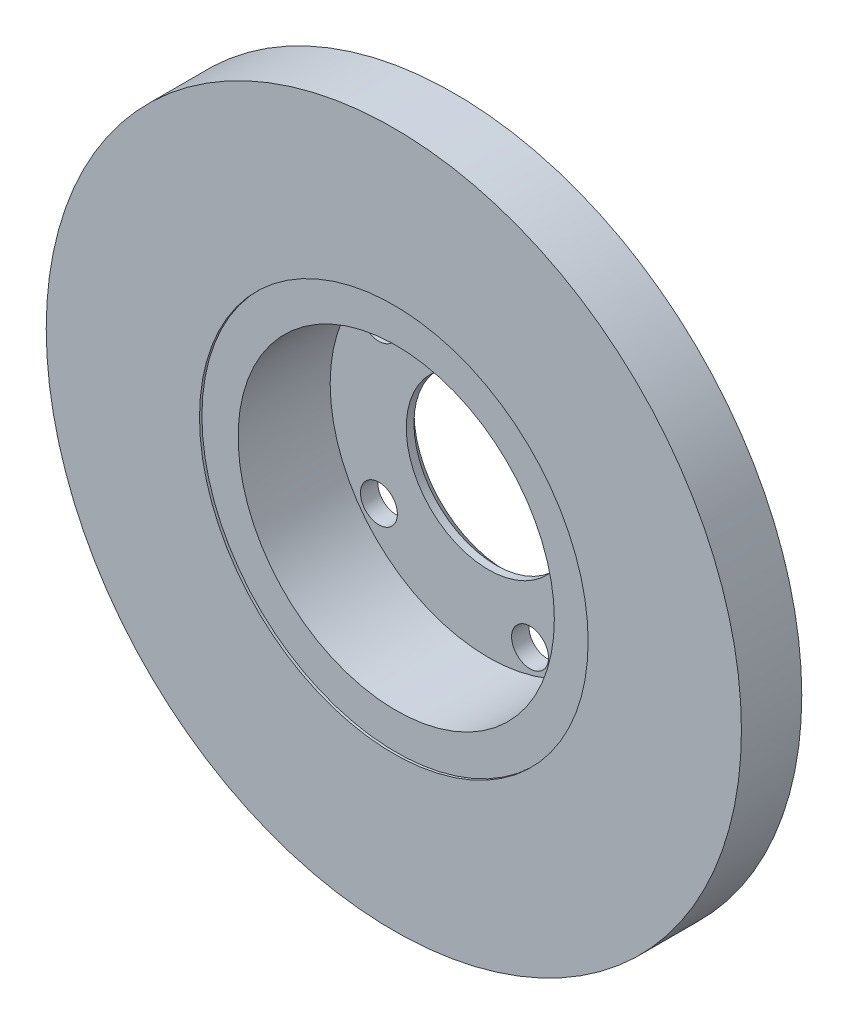
from build123d import *

# Parameters (mm, degrees)
BOSS_EXTRUDE1_START = 2.5
SKETCH1_R           = 144
BOSS_EXTRUDE1_DEPTH = 10
SKETCH2_R           = 80.5
CUT_EXTRUDE1_DEPTH  = 1
SKETCH3_R           = 65.5
CUT_EXTRUDE2_DEPTH  = 204.845529752
SKETCH4_R           = 74.125
SKETCH4_R_2         = 65.5
BOSS_EXTRUDE3_DEPTH = 36.33
BOSS_EXTRUDE4_START = -7.2
SKETCH5_R           = 74.125
BOSS_EXTRUDE4_DEPTH = 7.2
SKETCH6_R           = 34
CUT_EXTRUDE3_DEPTH  = 17.2
SKETCH7_R           = 144
SKETCH7_R_2         = 80.5
BOSS_EXTRUDE5_DEPTH = 15
CHAMFER2_SIZE       = 4
SKETCH10_R          = 7.65
CUT_EXTRUDE4_DEPTH  = 207.437566591
CIRPATTERN2_COUNT   = 5
CHAMFER3_SIZE       = 2
CUT_EXTRUDE6_DEPTH  = 2


with BuildPart() as part:
    # Sketch1 → Boss-Extrude1 (new body)
    with BuildSketch(Plane.XY.offset(BOSS_EXTRUDE1_START)):
        Circle(SKETCH1_R)
    extrude(amount=BOSS_EXTRUDE1_DEPTH)

    # Sketch2 → Cut-Extrude1 (cut)
    with BuildSketch(Plane.XY.offset(12.5)):
        Circle(SKETCH2_R)
    extrude(amount=-CUT_EXTRUDE1_DEPTH, mode=Mode.SUBTRACT)

    # Sketch3 → Cut-Extrude2 (cut, through all)
    with BuildSketch(Plane.XY.offset(11.5)):
        Circle(SKETCH3_R)
    extrude(amount=-CUT_EXTRUDE2_DEPTH, mode=Mode.SUBTRACT)

    # Sketch4 → Boss-Extrude3 (add)
    with BuildSketch(Plane(origin=(0, 0, 2.5), x_dir=(-1, 0, 0), z_dir=(0, 0, -1))):
        with Locations(Location((0, 0, 0), (0, 0, 180))):
            Circle(SKETCH4_R)
        with Locations(Location((0, 0, 0), (0, 0, 180))):
            Circle(SKETCH4_R_2, mode=Mode.SUBTRACT)
    extrude(amount=BOSS_EXTRUDE3_DEPTH)

    # Sketch5 → Boss-Extrude4 (add)
    with BuildSketch(Plane(origin=(0, 0, -33.83), x_dir=(-1, 0, 0), z_dir=(0, 0, -1)).offset(BOSS_EXTRUDE4_START)):
        with Locations(Location((0, 0, 0), (0, 0, 180))):
            Circle(SKETCH5_R)
    extrude(amount=BOSS_EXTRUDE4_DEPTH)

    # Sketch6 → Cut-Extrude3 (cut)
    with BuildSketch(Plane.XY.offset(-26.63)):
        Circle(SKETCH6_R)
    extrude(amount=-CUT_EXTRUDE3_DEPTH, mode=Mode.SUBTRACT)

    # Sketch7 → Boss-Extrude5 (add)
    with BuildSketch(Plane(origin=(0, 0, 2.5), x_dir=(-1, 0, 0), z_dir=(0, 0, -1))):
        Circle(SKETCH7_R)
        with Locations(Location((0, 0, 0), (0, 0, 180))):
            Circle(SKETCH7_R_2, mode=Mode.SUBTRACT)
    extrude(amount=BOSS_EXTRUDE5_DEPTH)

    # Chamfer2
    chamfer2_edges = [part.edges().sort_by_distance(p)[0] for p in [
        (-34, 0, -33.83),
    ]]
    chamfer(chamfer2_edges, length=CHAMFER2_SIZE)

    # Sketch10 → Cut-Extrude4 (cut, through all)
    with BuildSketch(Plane.XY):
        with Locations((56, 0)):
            Circle(SKETCH10_R)
    cut_extrude4 = extrude(amount=-CUT_EXTRUDE4_DEPTH, mode=Mode.SUBTRACT)

    # CirPattern2: Cut-Extrude4 ×5 about axis
    cirpattern2_axis = Axis((0, 0, 0), (0, 0, 1))
    for i in range(1, CIRPATTERN2_COUNT):
        add(cut_extrude4.rotate(cirpattern2_axis, i * 360 / CIRPATTERN2_COUNT), mode=Mode.SUBTRACT)

    # Chamfer3
    chamfer3_edges = [part.edges().sort_by_distance(p)[0] for p in [
        (-74.125, 0, -33.83),
    ]]
    chamfer(chamfer3_edges, length=CHAMFER3_SIZE)

    # Sketch12 → Cut-Extrude6 (cut)
    with BuildSketch(Plane(origin=(0, 0, -12.5), x_dir=(-1, 0, 0), z_dir=(0, 0, -1))):
        Polygon((-43.036764008, -72.137625021), (-71.215597585, -119.370593785), (-67.780472584, -121.4199635), (-39.601639007, -74.186994736), align=None)
        Polygon((-82.692946132, -15.293026515), (-137.190383486, -22.711201621), (-137.72988713, -18.747751632), (-83.232449776, -11.329576526), align=None)
        Polygon((-63.514778191, 55.116902592), (-103.293137449, 93.099558302), (-100.530762488, 95.992529884), (-60.75240323, 58.009874175), align=None)
        Polygon((3.491313194, 84.022679868), (8.385947883, 138.804451939), (12.370076761, 138.448478507), (7.475442071, 83.666706436), align=None)
        Polygon((67.868374533, 49.657665453), (113.750243417, 79.986762171), (115.955995905, 76.64989898), (70.074127022, 46.320802261), align=None)
        Polygon((81.139165587, -22.10058388), (133.458285575, -39.062590944), (132.224685062, -42.867617853), (79.905565073, -25.905610789), align=None)
        Polygon((33.310510016, -77.216642782), (52.669516643, -128.697016347), (48.925489474, -130.104944102), (29.566482848, -78.624570536), align=None)
    extrude(amount=-CUT_EXTRUDE6_DEPTH, mode=Mode.SUBTRACT)


solid = part.part
